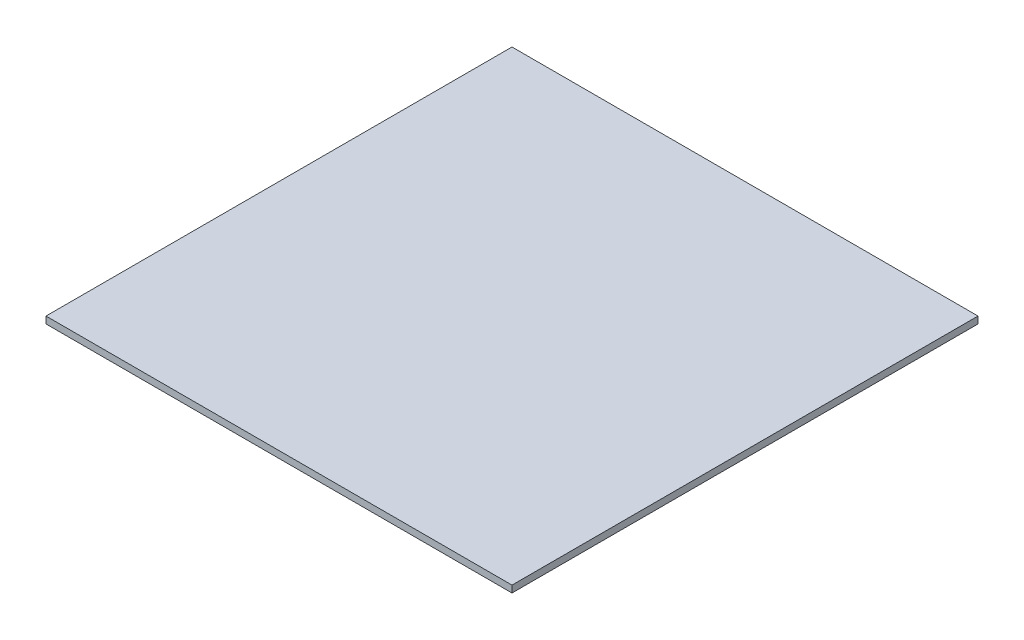
from build123d import *

# Parameters (mm, degrees)
CROQUIS1_W              = 610
CROQUIS1_H              = 610
SALIENTE_EXTRUIR1_DEPTH = 9


with BuildPart() as part:
    # Croquis1 → Saliente-Extruir1 (new body)
    with BuildSketch(Plane(origin=(0, 0, 0), x_dir=(1, 0, 0), z_dir=(0, 1, 0))):
        Rectangle(CROQUIS1_W, CROQUIS1_H)
    extrude(amount=SALIENTE_EXTRUIR1_DEPTH)


solid = part.part
